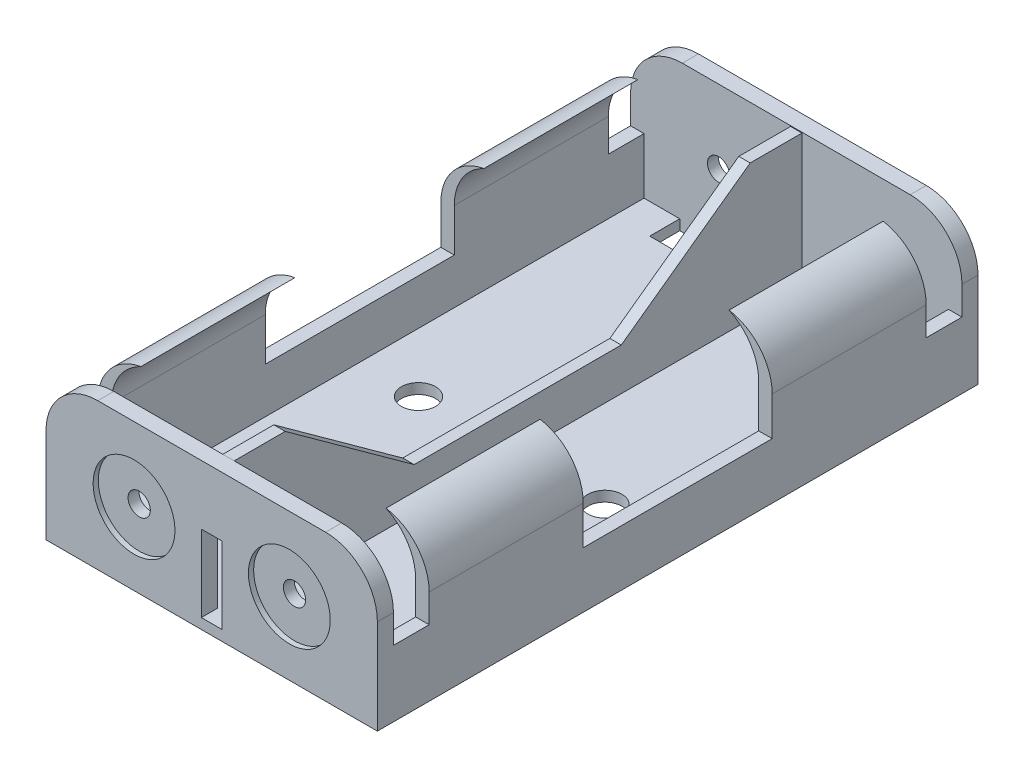
from build123d import *

# Parameters (mm, degrees)
SKETCH1_R           = 1.075
BOSS_EXTRUDE1_DEPTH = 29
CUT_EXTRUDE7_START  = -1.55
CUT_EXTRUDE7_DEPTH  = 54.9
BOSS_EXTRUDE2_DEPTH = 0.55
CUT_EXTRUDE8_REACH  = 47.442
SKETCH4_W           = 3.45
SKETCH4_H           = 15
SKETCH4_W_2         = 18.25
SKETCH4_H_2         = 16
SKETCH5_R           = 3.95
CUT_EXTRUDE9_DEPTH  = 0.5
SKETCH6_R           = 1.65
CUT_EXTRUDE10_DEPTH = 36.632283115
SKETCH10_W          = 2
SKETCH10_H          = 7.4
CUT_EXTRUDE11_DEPTH = 1.55
SKETCH12_R          = 1.075
CUT_EXTRUDE12_DEPTH = 1.55
SKETCH14_W          = 7.23
SKETCH14_H          = 2.9
CUT_EXTRUDE13_DEPTH = 1


with BuildPart() as part:
    # Sketch1 → Boss-Extrude1 (new, symmetric)
    with BuildSketch(Plane.XY):
        with BuildLine():
            Line((-11, 14.14), (11, 14.14))
            ThreePointArc((11, 14.14), (14.535533906, 12.675533906), (16, 9.14))
            Line((16, 9.14), (16, 0))
            Line((16, 0), (-16, 0))
            Line((-16, 0), (-16, 9.14))
            ThreePointArc((-16, 9.14), (-14.535533906, 12.675533906), (-11, 14.14))
        make_face()
        with Locations(Location((-7.5, 7, 0), (0, 0, 180))):
            Circle(SKETCH1_R, mode=Mode.SUBTRACT)
        with Locations(Location((7.5, 7, 0), (0, 0, 180))):
            Circle(SKETCH1_R, mode=Mode.SUBTRACT)
    extrude(amount=BOSS_EXTRUDE1_DEPTH, both=True)

    # Sketch2 → Cut-Extrude7 (cut)
    with BuildSketch(Plane.XY.offset(29).offset(CUT_EXTRUDE7_START)):
        with BuildLine():
            Line((-14.7, 1), (14.7, 1))
            Line((14.7, 1), (14.7, 9.55))
            ThreePointArc((14.7, 9.55), (13.235533906, 13.085533906), (9.7, 14.55))
            Line((9.7, 14.55), (-9.7, 14.55))
            ThreePointArc((-9.7, 14.55), (-13.235533906, 13.085533906), (-14.7, 9.55))
            Line((-14.7, 9.55), (-14.7, 1))
        make_face()
    extrude(amount=-CUT_EXTRUDE7_DEPTH, mode=Mode.SUBTRACT)

    # Sketch3 → Boss-Extrude2 (add, symmetric)
    with BuildSketch(Plane(origin=(0, 0, 0), x_dir=(0, 0, -1), z_dir=(1, 0, 0))):
        Polygon((27.45, 14.068958196), (22.45, 14.068958196), (10, 5.068958196), (-10, 5.068958196), (-22.45, 14.068958196), (-27.45, 14.068958196), (-27.45, 1), (27.45, 1), align=None)
    extrude(amount=BOSS_EXTRUDE2_DEPTH, both=True)

    # Sketch4 → Cut-Extrude8 (cut, up to next)
    with BuildSketch(Plane(origin=(16, 0, 0), x_dir=(0, 0, -1), z_dir=(1, 0, 0)), mode=Mode.PRIVATE) as cut_extrude8_sk1:
        with Locations((-25.725, 13.9)):
            Rectangle(SKETCH4_W, SKETCH4_H)
    cut_extrude8_tool1 = extrude(cut_extrude8_sk1.sketch, amount=-CUT_EXTRUDE8_REACH, mode=Mode.PRIVATE) & part.part
    # Sketch4 → Cut-Extrude8 (cut, up to next)
    with BuildSketch(Plane(origin=(16, 0, 0), x_dir=(0, 0, -1), z_dir=(1, 0, 0)), mode=Mode.PRIVATE) as cut_extrude8_sk2:
        with Locations((0, 13.4)):
            Rectangle(SKETCH4_W_2, SKETCH4_H_2)
    cut_extrude8_tool2 = extrude(cut_extrude8_sk2.sketch, amount=-CUT_EXTRUDE8_REACH, mode=Mode.PRIVATE) & part.part
    # Sketch4 → Cut-Extrude8 (cut, up to next)
    with BuildSketch(Plane(origin=(16, 0, 0), x_dir=(0, 0, -1), z_dir=(1, 0, 0)), mode=Mode.PRIVATE) as cut_extrude8_sk3:
        with Locations((25.725, 13.9)):
            Rectangle(SKETCH4_W, SKETCH4_H)
    cut_extrude8_tool3 = extrude(cut_extrude8_sk3.sketch, amount=-CUT_EXTRUDE8_REACH, mode=Mode.PRIVATE) & part.part
    cut_extrude8_1 = cut_extrude8_tool1.solids().sort_by_distance((16, 13.9, 25.725))[0]
    add(cut_extrude8_1, mode=Mode.SUBTRACT)
    cut_extrude8_2 = cut_extrude8_tool2.solids().sort_by_distance((16, 13.4, 0))[0]
    add(cut_extrude8_2, mode=Mode.SUBTRACT)
    cut_extrude8_3 = cut_extrude8_tool3.solids().sort_by_distance((16, 13.9, -25.725))[0]
    add(cut_extrude8_3, mode=Mode.SUBTRACT)
    cut_extrude8 = cut_extrude8_1 + cut_extrude8_2 + cut_extrude8_3  # Cut-Extrude8 as one shape, for the pattern or mirror that repeats it

    # Mirror1: Cut-Extrude8 across plane
    add(cut_extrude8.mirror(Plane(origin=(0, 0, 0), x_dir=(0, 0, 1), z_dir=(1, 0, 0))), mode=Mode.SUBTRACT)

    # Sketch5 → Cut-Extrude9 (cut)
    with BuildSketch(Plane(origin=(0, 0, -29), x_dir=(-1, 0, 0), z_dir=(0, 0, -1))):
        with Locations((-7.5, 7)):
            Circle(SKETCH5_R)
        with Locations((7.5, 7)):
            Circle(SKETCH5_R)
    cut_extrude9 = extrude(amount=-CUT_EXTRUDE9_DEPTH, mode=Mode.SUBTRACT)

    # Mirror2: Cut-Extrude9 across plane
    add(cut_extrude9.mirror(Plane.XY), mode=Mode.SUBTRACT)

    # Sketch6 → Cut-Extrude10 (cut, through all)
    with BuildSketch(Plane(origin=(0, 1, 0), x_dir=(1, 0, 0), z_dir=(0, 1, 0))):
        with Locations(Location((-9, -0.03, 0), (0, 0, 270))):
            Circle(SKETCH6_R)
        with Locations(Location((9, -0.03, 0), (0, 0, 90))):
            Circle(SKETCH6_R)
    extrude(amount=-CUT_EXTRUDE10_DEPTH, mode=Mode.SUBTRACT)

    # Sketch10 → Cut-Extrude11 (cut)
    with BuildSketch(Plane.XY.offset(29)):
        with Locations((0, 4.7)):
            Rectangle(SKETCH10_W, SKETCH10_H)
    extrude(amount=-CUT_EXTRUDE11_DEPTH, mode=Mode.SUBTRACT)

    # Sketch12 → Cut-Extrude12 (cut)
    with BuildSketch(Plane(origin=(0, 0, -29), x_dir=(-1, 0, 0), z_dir=(0, 0, -1))):
        with Locations((-2.5, 2.5)):
            Circle(SKETCH12_R)
        with Locations((2.5, 2.5)):
            Circle(SKETCH12_R)
    extrude(amount=-CUT_EXTRUDE12_DEPTH, mode=Mode.SUBTRACT)

    # Sketch14 → Cut-Extrude13 (cut)
    with BuildSketch(Plane.XZ):
        with Locations((-7.635, 26)):
            Rectangle(SKETCH14_W, SKETCH14_H)
        with Locations((7.595, 26)):
            Rectangle(SKETCH14_W, SKETCH14_H)
    cut_extrude13 = extrude(amount=-CUT_EXTRUDE13_DEPTH, mode=Mode.SUBTRACT)

    # Mirror3: Cut-Extrude13 across plane
    add(cut_extrude13.mirror(Plane.XY), mode=Mode.SUBTRACT)


solid = part.part
